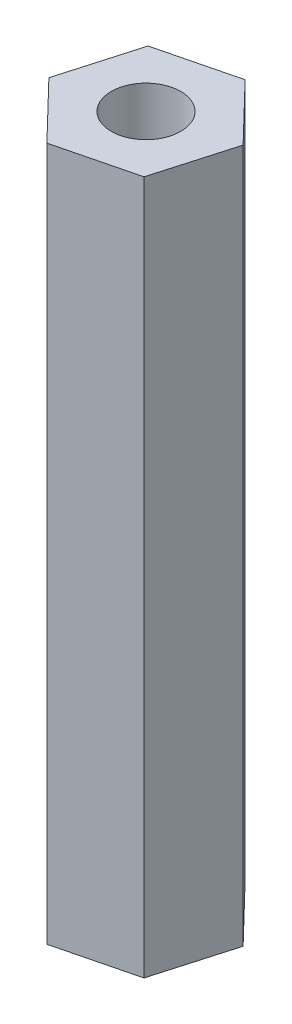
from build123d import *

# Parameters (mm, degrees)
RESSALTO_EXTRUS_O1_DEPTH = 30
ESBO_O2_R                = 1.5
CORTE_EXTRUS_O1_DEPTH    = 30


with BuildPart() as part:
    # Esboço1 → Ressalto-extrusão1 (new body)
    with BuildSketch(Plane(origin=(0, 0, 0), x_dir=(1, 0, 0), z_dir=(0, 1, 0))):
        Polygon((2.406145977, -2.492079762), (3.36127737, 0.83774366), (0.955131393, 3.329823422), (-2.406145977, 2.492079762), (-3.36127737, -0.83774366), (-0.955131393, -3.329823422), align=None)
    extrude(amount=RESSALTO_EXTRUS_O1_DEPTH)

    # Esboço2 → Corte-extrusão1 (cut)
    with BuildSketch(Plane.XZ):
        with Locations(Location((0, 0, 0), (0, 0, 270))):
            Circle(ESBO_O2_R)
    extrude(amount=-CORTE_EXTRUS_O1_DEPTH, mode=Mode.SUBTRACT)


solid = part.part
